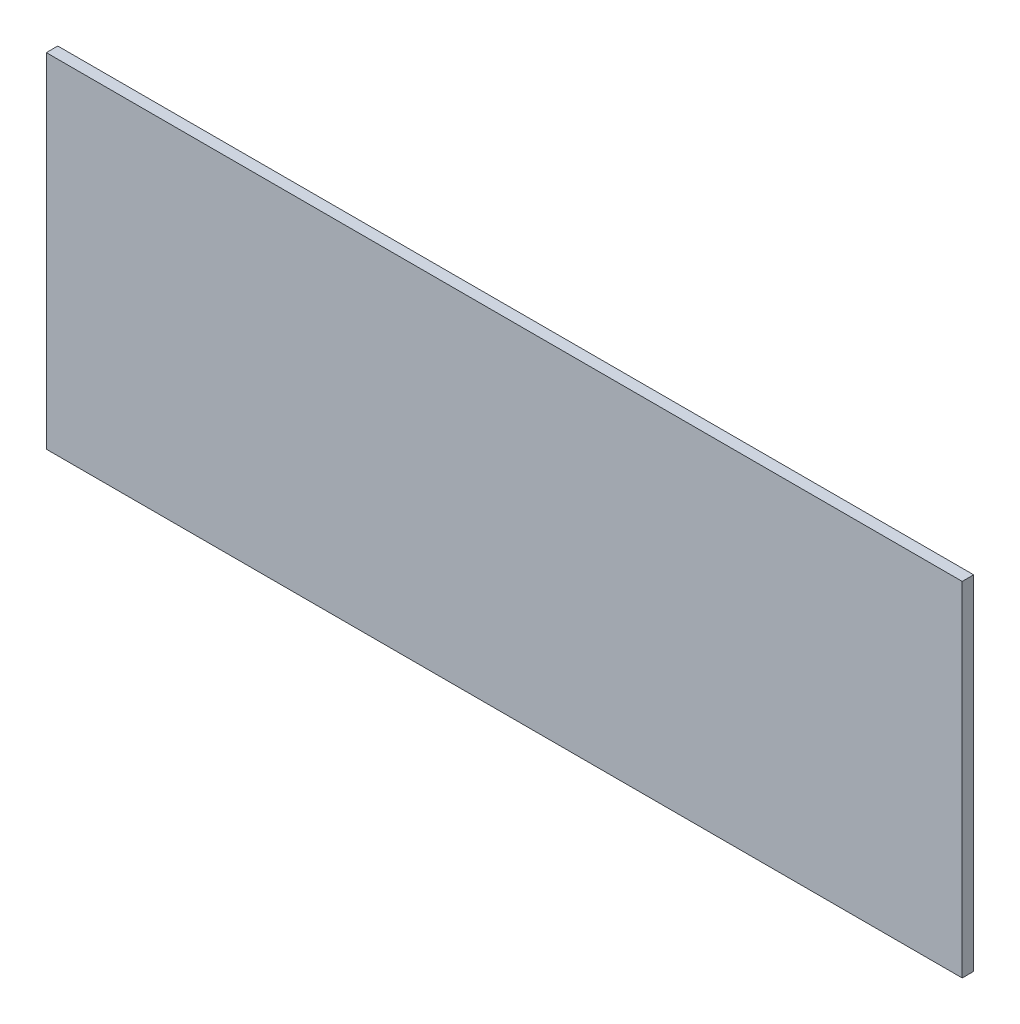
from build123d import *

# Parameters (mm, degrees)
SKETCH1_W           = 80
SKETCH1_H           = 30
BOSS_EXTRUDE1_DEPTH = 1


with BuildPart() as part:
    # Sketch1 → Boss-Extrude1 (new body)
    with BuildSketch(Plane.XY):
        Rectangle(SKETCH1_W, SKETCH1_H)
    extrude(amount=BOSS_EXTRUDE1_DEPTH)


solid = part.part
